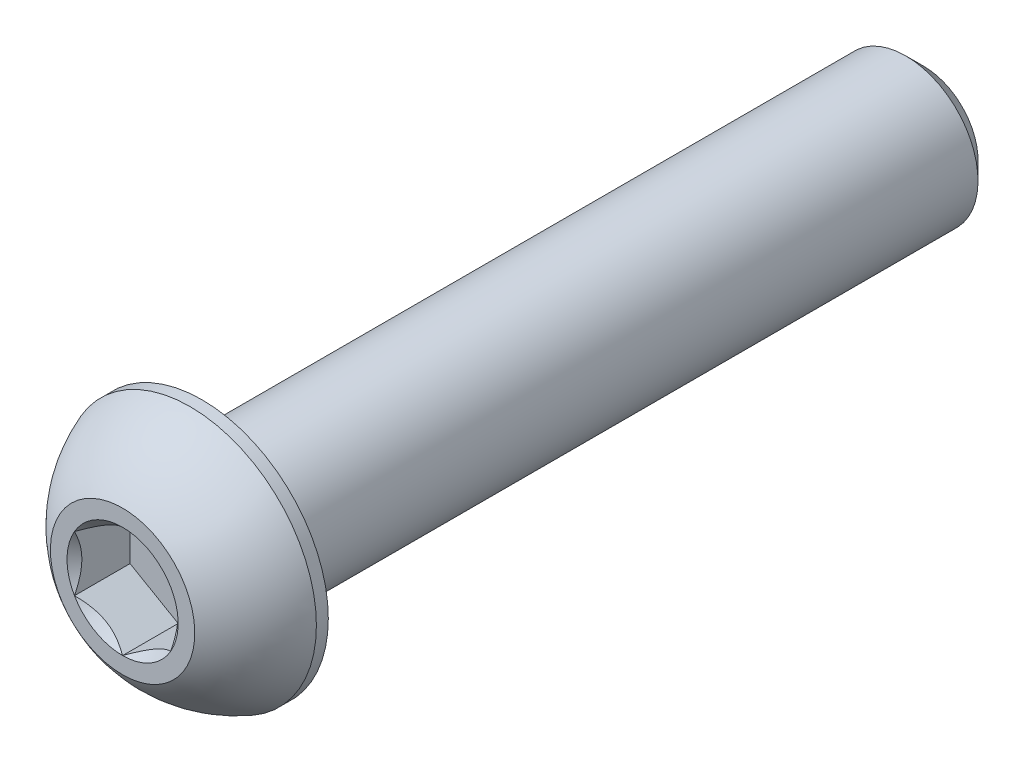
from build123d import *

# Parameters (mm, degrees)
SKETCH1_W          = 30
SKETCH1_H          = 3
CHAMFER1_SIZE      = 0.75
CUT_EXTRUDE2_DEPTH = 2.31


with BuildPart() as part:
    # Sketch1 → Revolve1 (revolve)
    with BuildSketch(Plane(origin=(0, 0, 0), x_dir=(0, 0, -1), z_dir=(1, 0, 0))):
        with Locations((18.3, 1.5)):
            Rectangle(SKETCH1_W, SKETCH1_H)
    revolve(axis=Axis((0, 0, -33.3), (0, 0, 1)))

    # Chamfer1
    chamfer1_edges = [part.edges().sort_by_distance(p)[0] for p in [
        (0, -3, -33.3),
    ]]
    chamfer(chamfer1_edges, length=CHAMFER1_SIZE)

    # Sketch7 → Revolve2 (revolve)
    with BuildSketch(Plane(origin=(0, 0, 0), x_dir=(0, 0, -1), z_dir=(1, 0, 0))):
        with BuildLine():
            Line((2.805, 5.25), (3.3, 5.25))
            Line((3.3, 5.25), (3.3, 0))
            Line((3.3, 0), (0, 0))
            Line((0, 0), (0, 3))
            ThreePointArc((0, 3), (1.216479019, 4.356906156), (2.805, 5.25))
        make_face()
    revolve(axis=Axis((0, 0, 0), (0, 0, -1)))

    # Sketch5 → Cut-Extrude2 (cut)
    with BuildSketch(Plane.XY):
        Polygon((2, -1.154700538), (2, 1.154700538), (0, 2.309401077), (-2, 1.154700538), (-2, -1.154700538), (0, -2.309401077), align=None)
    extrude(amount=-CUT_EXTRUDE2_DEPTH, mode=Mode.SUBTRACT)

    # Cut-Extrude3 cone 1 section (through the dimple's axis) → Cut-Extrude3 (revolve, cut)
    with BuildSketch(Plane(origin=(0, 0, 0), x_dir=(0, -1, 0), z_dir=(1, 0, 0))):
        Polygon((0, 0), (2.309401077, 0), (0, 2.309401077), align=None)
    revolve(axis=Axis((0, 0, 0), (0, 0, -1)), mode=Mode.SUBTRACT)


solid = part.part
